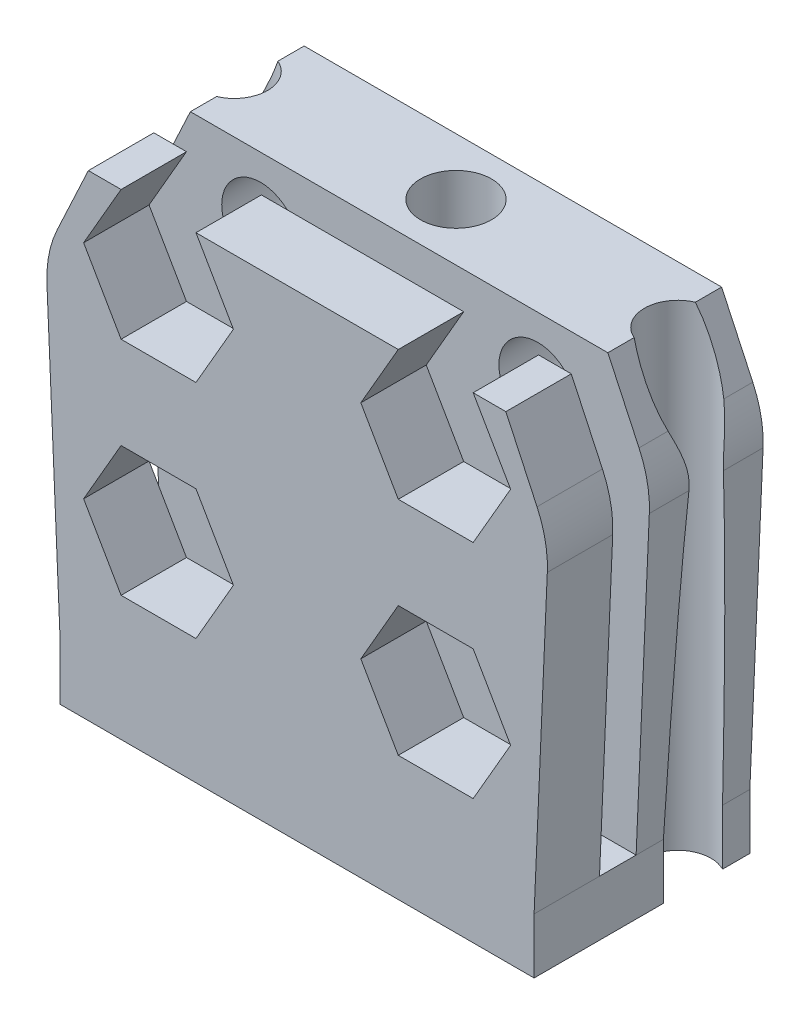
from build123d import *

# Parameters (mm, degrees)
SKETCH1_R           = 1.5
BOSS_EXTRUDE1_DEPTH = 5.13
SKETCH2_W           = 21.373732632
SKETCH2_H           = 5.13
BOSS_EXTRUDE2_DEPTH = 2.5
SKETCH3_W           = 21.373732632
SKETCH3_H           = 2.5
BOSS_EXTRUDE3_DEPTH = 4.6
BOSS_EXTRUDE4_START = -2.95
BOSS_EXTRUDE4_DEPTH = 2.95
CUT_EXTRUDE1_REACH  = 103.599
SKETCH5_R           = 1.75
SKETCH6_R           = 1.6
SKETCH6_R_2         = 1.5
CUT_EXTRUDE2_DEPTH  = 34.549423701
CUT_EXTRUDE3_REACH  = 103.262


with BuildPart() as part:
    # Sketch1 → Boss-Extrude1 (new body)
    with BuildSketch(Plane.XY):
        with BuildLine():
            Line((-11.282357346, 86.580844321), (-10.686866316, 72.941857381))
            Line((-10.686866316, 72.941857381), (10.686866316, 72.941857381))
            Line((10.686866316, 72.941857381), (11.282357346, 86.580844321))
            ThreePointArc((11.282357346, 86.580844321), (11.19104264, 87.774392868), (10.818655174, 88.912032567))
            Line((10.818655174, 88.912032567), (7.70361619, 95.592255225))
            ThreePointArc((7.70361619, 95.592255225), (0, 100.5), (-7.70361619, 95.592255225))
            Line((-7.70361619, 95.592255225), (-10.818655174, 88.912032567))
            ThreePointArc((-10.818655174, 88.912032567), (-11.19104264, 87.774392868), (-11.282357346, 86.580844321))
        make_face()
        with Locations((-6.25, 79)):
            Circle(SKETCH1_R, mode=Mode.SUBTRACT)
        with Locations((-6.25, 89)):
            Circle(SKETCH1_R, mode=Mode.SUBTRACT)
        with Locations((6.25, 79)):
            Circle(SKETCH1_R, mode=Mode.SUBTRACT)
        with Locations((6.25, 89)):
            Circle(SKETCH1_R, mode=Mode.SUBTRACT)
    extrude(amount=BOSS_EXTRUDE1_DEPTH)

    # Sketch2 → Boss-Extrude2 (add)
    with BuildSketch(Plane.XZ.offset(-72.941857381)):
        with Locations((0, 2.565)):
            Rectangle(SKETCH2_W, SKETCH2_H)
    extrude(amount=BOSS_EXTRUDE2_DEPTH)

    # Sketch3 → Boss-Extrude3 (add)
    with BuildSketch(Plane.XY.offset(5.13)):
        with Locations((0, 71.691857381)):
            Rectangle(SKETCH3_W, SKETCH3_H)
    extrude(amount=BOSS_EXTRUDE3_DEPTH)

    # Sketch4 → Boss-Extrude4 (add)
    with BuildSketch(Plane.XY.offset(9.73).offset(BOSS_EXTRUDE4_START)):
        with BuildLine():
            Line((4.561250463, 86.075), (2.872500925, 89))
            Line((2.872500925, 89), (4.561250463, 91.925))
            Line((4.561250463, 91.925), (-4.561250463, 91.925))
            Line((-4.561250463, 91.925), (-2.872500925, 89))
            Line((-2.872500925, 89), (-4.561250463, 86.075))
            Line((-4.561250463, 86.075), (-7.938749537, 86.075))
            Line((-7.938749537, 86.075), (-9.627499075, 89))
            Line((-9.627499075, 89), (-7.938749537, 91.925))
            Line((-7.938749537, 91.925), (-9.413685386, 91.925))
            Line((-9.413685386, 91.925), (-10.818655174, 88.912032567))
            ThreePointArc((-10.818655174, 88.912032567), (-11.19104264, 87.774392868), (-11.282357346, 86.580844321))
            Line((-11.282357346, 86.580844321), (-10.686866316, 72.941857381))
            Line((-10.686866316, 72.941857381), (10.686866316, 72.941857381))
            Line((10.686866316, 72.941857381), (11.282357346, 86.580844321))
            ThreePointArc((11.282357346, 86.580844321), (11.19104264, 87.774392868), (10.818655174, 88.912032567))
            Line((10.818655174, 88.912032567), (9.413685386, 91.925))
            Line((9.413685386, 91.925), (7.938749537, 91.925))
            Line((7.938749537, 91.925), (9.627499075, 89))
            Line((9.627499075, 89), (7.938749537, 86.075))
            Line((7.938749537, 86.075), (4.561250463, 86.075))
        make_face()
        Polygon((-4.561250463, 81.925), (-2.872500925, 79), (-4.561250463, 76.075), (-7.938749537, 76.075), (-9.627499075, 79), (-7.938749537, 81.925), align=None, mode=Mode.SUBTRACT)
        Polygon((7.938749537, 81.925), (9.627499075, 79), (7.938749537, 76.075), (4.561250463, 76.075), (2.872500925, 79), (4.561250463, 81.925), align=None, mode=Mode.SUBTRACT)
    extrude(amount=BOSS_EXTRUDE4_DEPTH)

    # Sketch5 → Cut-Extrude1 (cut, up to next)
    with BuildSketch(Plane(origin=(0, 0, 0), x_dir=(-1, 0, 0), z_dir=(0, 0, -1)), mode=Mode.PRIVATE) as cut_extrude1_sk1:
        with Locations((-6.25, 89)):
            Circle(SKETCH5_R)
    cut_extrude1_tool1 = extrude(cut_extrude1_sk1.sketch, amount=-CUT_EXTRUDE1_REACH, mode=Mode.PRIVATE) & part.part
    # Sketch5 → Cut-Extrude1 (cut, up to next)
    with BuildSketch(Plane(origin=(0, 0, 0), x_dir=(-1, 0, 0), z_dir=(0, 0, -1)), mode=Mode.PRIVATE) as cut_extrude1_sk2:
        with Locations((6.25, 89)):
            Circle(SKETCH5_R)
    cut_extrude1_tool2 = extrude(cut_extrude1_sk2.sketch, amount=-CUT_EXTRUDE1_REACH, mode=Mode.PRIVATE) & part.part
    # Sketch5 → Cut-Extrude1 (cut, up to next)
    with BuildSketch(Plane(origin=(0, 0, 0), x_dir=(-1, 0, 0), z_dir=(0, 0, -1)), mode=Mode.PRIVATE) as cut_extrude1_sk3:
        with Locations((6.25, 79)):
            Circle(SKETCH5_R)
    cut_extrude1_tool3 = extrude(cut_extrude1_sk3.sketch, amount=-CUT_EXTRUDE1_REACH, mode=Mode.PRIVATE) & part.part
    # Sketch5 → Cut-Extrude1 (cut, up to next)
    with BuildSketch(Plane(origin=(0, 0, 0), x_dir=(-1, 0, 0), z_dir=(0, 0, -1)), mode=Mode.PRIVATE) as cut_extrude1_sk4:
        with Locations((-6.25, 79)):
            Circle(SKETCH5_R)
    cut_extrude1_tool4 = extrude(cut_extrude1_sk4.sketch, amount=-CUT_EXTRUDE1_REACH, mode=Mode.PRIVATE) & part.part
    add(cut_extrude1_tool1.solids().sort_by_distance((6.25, 89, 0))[0], mode=Mode.SUBTRACT)
    add(cut_extrude1_tool2.solids().sort_by_distance((-6.25, 89, 0))[0], mode=Mode.SUBTRACT)
    add(cut_extrude1_tool3.solids().sort_by_distance((-6.25, 79, 0))[0], mode=Mode.SUBTRACT)
    add(cut_extrude1_tool4.solids().sort_by_distance((6.25, 79, 0))[0], mode=Mode.SUBTRACT)

    # Sketch6 → Cut-Extrude2 (cut, through all)
    with BuildSketch(Plane.XZ.offset(-70.441857381)):
        with Locations(Location((0, 2.565, 0), (0, 0, 270))):
            Circle(SKETCH6_R)
        with Locations((-10, 2.565)):
            Circle(SKETCH6_R_2)
        with Locations((10, 2.565)):
            Circle(SKETCH6_R_2)
    extrude(amount=-CUT_EXTRUDE2_DEPTH, mode=Mode.SUBTRACT)

    # Sketch7 → Cut-Extrude3 (cut, up to next)
    with BuildSketch(Plane.XY.offset(5.13), mode=Mode.PRIVATE) as cut_extrude3_sk1:
        with BuildLine():
            Line((-7.70361619, 95.592255225), (-9.413685386, 91.925))
            Line((-9.413685386, 91.925), (9.413685386, 91.925))
            Line((9.413685386, 91.925), (7.70361619, 95.592255225))
            ThreePointArc((7.70361619, 95.592255225), (0, 100.5), (-7.70361619, 95.592255225))
        make_face()
    cut_extrude3_tool1 = extrude(cut_extrude3_sk1.sketch, amount=-CUT_EXTRUDE3_REACH, mode=Mode.PRIVATE) & part.part
    add(cut_extrude3_tool1.solids().sort_by_distance((0, 95.513825, 5.13))[0], mode=Mode.SUBTRACT)


solid = part.part
